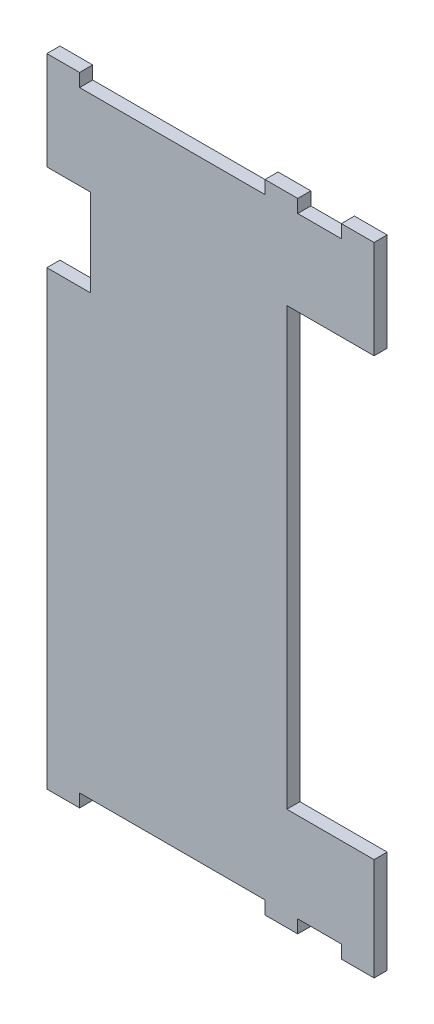
from build123d import *

# Parameters (mm, degrees)
ESBO_O1_W                = 150
ESBO_O1_H                = 292
RESSALTO_EXTRUS_O1_DEPTH = 6
ESBO_O2_W                = 40
ESBO_O2_H                = 200
CORTE_EXTRUS_O1_DEPTH    = 329.329103188
ESBO_O5_W                = 20
ESBO_O5_H                = 6
ESBO_O5_W_2              = 85
CORTE_EXTRUS_O2_DEPTH    = 329.329103188
ESBO_O7_W                = 20
ESBO_O7_H                = 40
CORTE_EXTRUS_O3_DEPTH    = 329.329103188


with BuildPart() as part:
    # Esboço1 → Ressalto-extrusão1 (new body)
    with BuildSketch(Plane.XY):
        with Locations((75, 146)):
            Rectangle(ESBO_O1_W, ESBO_O1_H)
    extrude(amount=RESSALTO_EXTRUS_O1_DEPTH)

    # Esboço2 → Corte-extrusão1 (cut, through all)
    with BuildSketch(Plane(origin=(0, 0, 0), x_dir=(-1, 0, 0), z_dir=(0, 0, -1))):
        with Locations((-130, 147)):
            Rectangle(ESBO_O2_W, ESBO_O2_H)
    extrude(amount=-CORTE_EXTRUS_O1_DEPTH, mode=Mode.SUBTRACT)

    # Esboço5 → Corte-extrusão2 (cut, through all)
    with BuildSketch(Plane(origin=(0, 0, 0), x_dir=(-1, 0, 0), z_dir=(0, 0, -1))):
        with Locations((-125, 289)):
            Rectangle(ESBO_O5_W, ESBO_O5_H)
        with Locations((-57.5, 289)):
            Rectangle(ESBO_O5_W_2, ESBO_O5_H)
        with Locations((-125, 3)):
            Rectangle(ESBO_O5_W, ESBO_O5_H)
        with Locations((-57.5, 3)):
            Rectangle(ESBO_O5_W_2, ESBO_O5_H)
    extrude(amount=-CORTE_EXTRUS_O2_DEPTH, mode=Mode.SUBTRACT)

    # Esboço7 → Corte-extrusão3 (cut, through all)
    with BuildSketch(Plane(origin=(0, 0, 0), x_dir=(-1, 0, 0), z_dir=(0, 0, -1))):
        with Locations((-10, 227)):
            Rectangle(ESBO_O7_W, ESBO_O7_H)
    extrude(amount=-CORTE_EXTRUS_O3_DEPTH, mode=Mode.SUBTRACT)


solid = part.part
